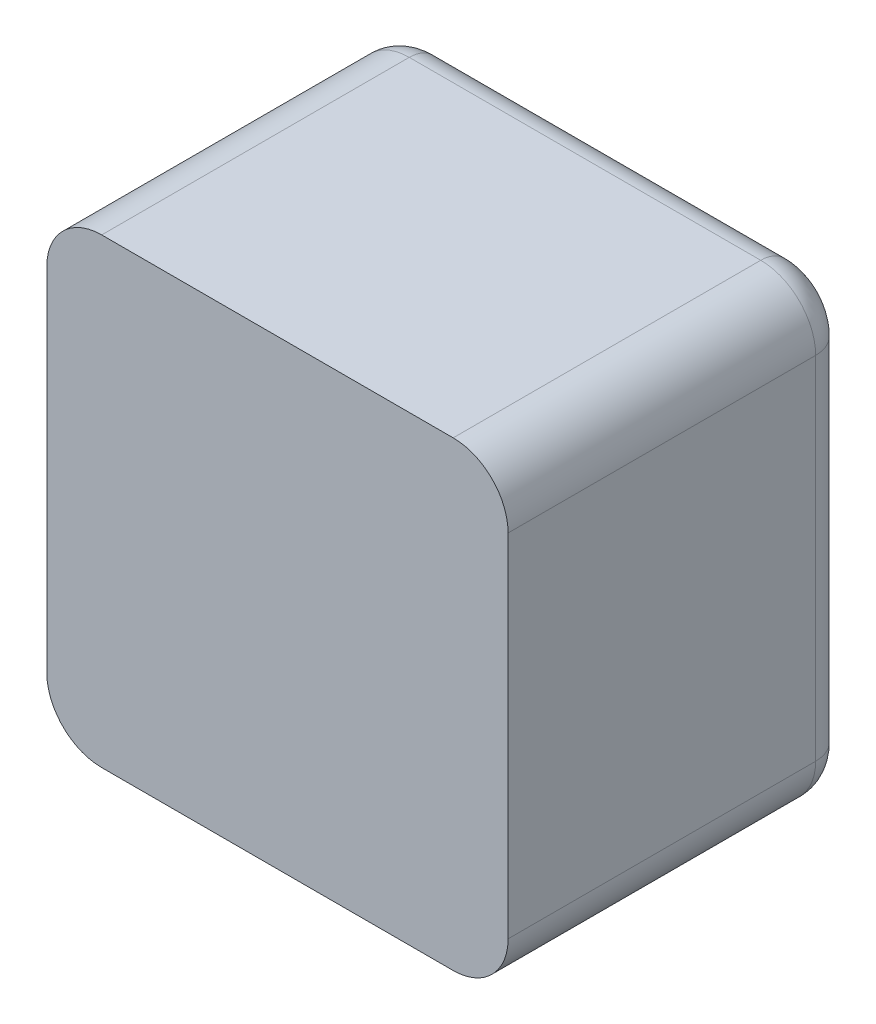
from build123d import *

# Parameters (mm, degrees)
ESQUISSE1_W             = 84
ESQUISSE1_H             = 84
BOSS_EXTRU_1_DEPTH      = 60
CONG_1_R                = 10
CONG_2_R                = 6
BOSS_EXTRU_2_DEPTH      = 2
ESQUISSE5_R             = 3.175
ENL_V_MAT_EXTRU_1_DEPTH = 6
ENL_V_MAT_EXTRU_2_DEPTH = 9
ESQUISSE7_R             = 3.175
ENL_V_MAT_EXTRU_3_DEPTH = 6
BOSS_EXTRU_3_START      = 2
BOSS_EXTRU_3_DEPTH      = 2


with BuildPart() as part:
    # Esquisse1 → Boss.-Extru.1 (new body)
    with BuildSketch(Plane.XY):
        with Locations((12.35180193, 14.109375)):
            Rectangle(ESQUISSE1_W, ESQUISSE1_H)
    extrude(amount=BOSS_EXTRU_1_DEPTH)

    # Congé1
    cong_1_edges = [part.edges().sort_by_distance(p)[0] for p in [
        (-29.64819807, 56.109375, 30),
        (54.35180193, 56.109375, 30),
        (54.35180193, -27.890625, 30),
        (-29.64819807, -27.890625, 30),
    ]]
    fillet(cong_1_edges, radius=CONG_1_R)

    # Congé2
    cong_2_edges = [part.edges().sort_by_distance(p)[0] for p in [
        (12.35180193, -27.890625, 0),
        (-29.64819807, 14.109375, 0),
        (12.35180193, 56.109375, 0),
        (54.35180193, 14.109375, 0),
        (51.422869741, 53.180442812, 0),
        (-26.719265882, 53.180442812, 0),
        (51.422869741, -24.961692812, 0),
        (-26.719265882, -24.961692812, 0),
    ]]
    fillet(cong_2_edges, radius=CONG_2_R)

    # Esquisse2 → Boss.-Extru.2 (add)
    with BuildSketch(Plane.XZ.offset(27.890625)):
        with BuildLine():
            Line((24.35180193, 57), (0.35180193, 57))
            ThreePointArc((0.35180193, 57), (-10.254799788, 52.606601718), (-14.64819807, 42))
            Line((-14.64819807, 42), (-14.64819807, 25))
            ThreePointArc((-14.64819807, 25), (-10.254799788, 14.393398282), (0.35180193, 10))
            Line((0.35180193, 10), (24.35180193, 10))
            ThreePointArc((24.35180193, 10), (34.958403647, 14.393398282), (39.35180193, 25))
            Line((39.35180193, 25), (39.35180193, 42))
            ThreePointArc((39.35180193, 42), (34.958403647, 52.606601718), (24.35180193, 57))
        make_face()
    extrude(amount=BOSS_EXTRU_2_DEPTH)

    # Esquisse5 → Enlèv. mat.-Extru.1 (cut)
    with BuildSketch(Plane.XZ.offset(29.890625)):
        with Locations(Location((12.35180193, 34, 0), (0, 0, 270))):
            Circle(ESQUISSE5_R)
    extrude(amount=-ENL_V_MAT_EXTRU_1_DEPTH, mode=Mode.SUBTRACT)

    # Esquisse6 → Enlèv. mat.-Extru.2 (cut)
    with BuildSketch(Plane(origin=(0, 0, 0), x_dir=(-1, 0, 0), z_dir=(0, 0, -1))):
        with BuildLine():
            Line((-34.85180193, -1.890625), (10.14819807, -1.890625))
            ThreePointArc((10.14819807, -1.890625), (16.64819807, -8.390625), (10.14819807, -14.890625))
            Line((10.14819807, -14.890625), (-34.85180193, -14.890625))
            ThreePointArc((-34.85180193, -14.890625), (-41.35180193, -8.390625), (-34.85180193, -1.890625))
        make_face()
    extrude(amount=-ENL_V_MAT_EXTRU_2_DEPTH, mode=Mode.SUBTRACT)

    # Esquisse7 → Enlèv. mat.-Extru.3 (cut)
    with BuildSketch(Plane(origin=(0, 0, 0), x_dir=(-1, 0, 0), z_dir=(0, 0, -1))):
        with Locations((-14.35180193, 21.109375)):
            Circle(ESQUISSE7_R)
    extrude(amount=-ENL_V_MAT_EXTRU_3_DEPTH, mode=Mode.SUBTRACT)

    # Esquisse8 → Boss.-Extru.3 (add)
    with BuildSketch(Plane.XY.offset(60).offset(BOSS_EXTRU_3_START)):
        with BuildLine():
            Line((-19.64819807, 56.109375), (44.35180193, 56.109375))
            ThreePointArc((44.35180193, 56.109375), (51.422869741, 53.180442812), (54.35180193, 46.109375))
            Line((54.35180193, 46.109375), (54.35180193, -17.890625))
            ThreePointArc((54.35180193, -17.890625), (51.422869741, -24.961692812), (44.35180193, -27.890625))
            Line((44.35180193, -27.890625), (-19.64819807, -27.890625))
            ThreePointArc((-19.64819807, -27.890625), (-26.719265882, -24.961692812), (-29.64819807, -17.890625))
            Line((-29.64819807, -17.890625), (-29.64819807, 46.109375))
            ThreePointArc((-29.64819807, 46.109375), (-26.719265882, 53.180442812), (-19.64819807, 56.109375))
        make_face()
    extrude(amount=-BOSS_EXTRU_3_DEPTH)


solid = part.part
